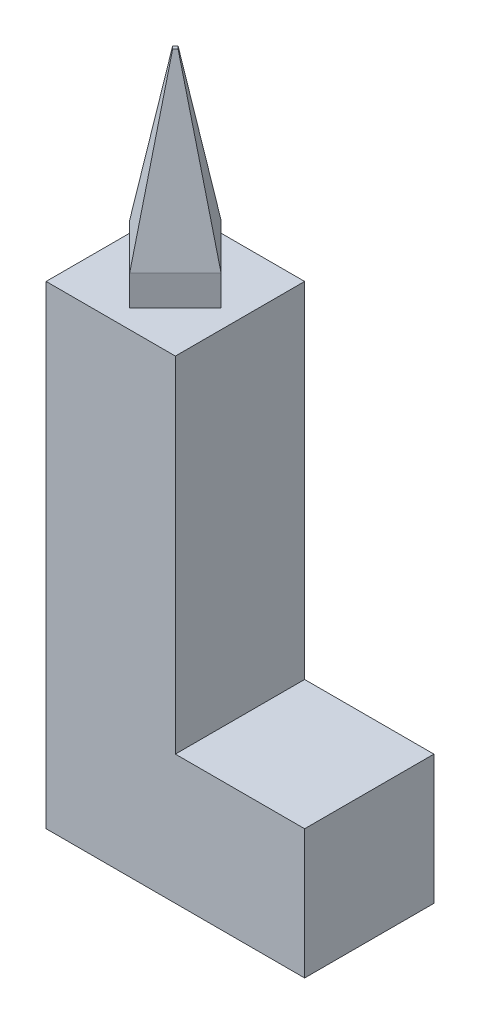
from build123d import *
from OCP.BRepFilletAPI import BRepFilletAPI_MakeChamfer

# Parameters (mm, degrees)
SKETCH_1_W      = 60
SKETCH_1_H      = 30
EXTRUDE_1_DEPTH = 30
SKETCH_2_W      = 30
SKETCH_2_H      = 30
EXTRUDE_2_DEPTH = 80
EXTRUDE_3_DEPTH = 47
CHAMFER_1_SIZE  = 40
CHAMFER_1_SIZE2 = 7.053079228


with BuildPart() as part:
    # ｽｹｯﾁ1 → ﾎﾞｽ - 押し出し1 (new body)
    with BuildSketch(Plane(origin=(0, 0, 0), x_dir=(1, 0, 0), z_dir=(0, 1, 0))):
        with Locations((30, -15)):
            Rectangle(SKETCH_1_W, SKETCH_1_H)
    extrude(amount=EXTRUDE_1_DEPTH)

    # ｽｹｯﾁ2 → ﾎﾞｽ - 押し出し2 (add)
    with BuildSketch(Plane(origin=(0, 30, 0), x_dir=(1, 0, 0), z_dir=(0, 1, 0))):
        with Locations((15, -15)):
            Rectangle(SKETCH_2_W, SKETCH_2_H)
    extrude(amount=EXTRUDE_2_DEPTH)

    # ｽｹｯﾁ3 → ﾎﾞｽ - 押し出し3 (add)
    with BuildSketch(Plane(origin=(0, 110, 0), x_dir=(1, 0, 0), z_dir=(0, 1, 0))):
        Polygon((4.393398282, -15), (15, -4.393398282), (25.606601718, -15), (15, -25.606601718), align=None)
    extrude(amount=EXTRUDE_3_DEPTH)

    # 面取り1: one chamfer whose edges measure the first distance from different faces: ONE call of the kernel's chamfer builder (chamfer() names one face for all edges)
    chamfer_1_edges_1 = [part.edges().sort_by_distance(p)[0] for p in [
        (9.696699141, 157, 9.696699141),
    ]]
    chamfer_1_side_1 = [part.faces().sort_by_distance(p)[0] for p in [
        (9.696699141, 133.5, 9.696699141),
    ]]
    chamfer_1_edges_2 = [part.edges().sort_by_distance(p)[0] for p in [
        (20.303300859, 157, 9.696699141),
    ]]
    chamfer_1_side_2 = [part.faces().sort_by_distance(p)[0] for p in [
        (20.303300859, 133.5, 9.696699141),
    ]]
    chamfer_1_edges_3 = [part.edges().sort_by_distance(p)[0] for p in [
        (20.303300859, 157, 20.303300859),
    ]]
    chamfer_1_side_3 = [part.faces().sort_by_distance(p)[0] for p in [
        (20.303300859, 133.5, 20.303300859),
    ]]
    chamfer_1_edges_4 = [part.edges().sort_by_distance(p)[0] for p in [
        (9.696699141, 157, 20.303300859),
    ]]
    chamfer_1_side_4 = [part.faces().sort_by_distance(p)[0] for p in [
        (9.696699141, 133.5, 20.303300859),
    ]]
    chamfer_1 = BRepFilletAPI_MakeChamfer(part.part.solid().wrapped)
    for e in chamfer_1_edges_1:
        chamfer_1.Add(CHAMFER_1_SIZE, CHAMFER_1_SIZE2, e.wrapped, chamfer_1_side_1[0].wrapped)  # the first distance lies on this face
    for e in chamfer_1_edges_2:
        chamfer_1.Add(CHAMFER_1_SIZE, CHAMFER_1_SIZE2, e.wrapped, chamfer_1_side_2[0].wrapped)  # the first distance lies on this face
    for e in chamfer_1_edges_3:
        chamfer_1.Add(CHAMFER_1_SIZE, CHAMFER_1_SIZE2, e.wrapped, chamfer_1_side_3[0].wrapped)  # the first distance lies on this face
    for e in chamfer_1_edges_4:
        chamfer_1.Add(CHAMFER_1_SIZE, CHAMFER_1_SIZE2, e.wrapped, chamfer_1_side_4[0].wrapped)  # the first distance lies on this face
    add(Compound.cast(chamfer_1.Shape()), mode=Mode.REPLACE)


solid = part.part
